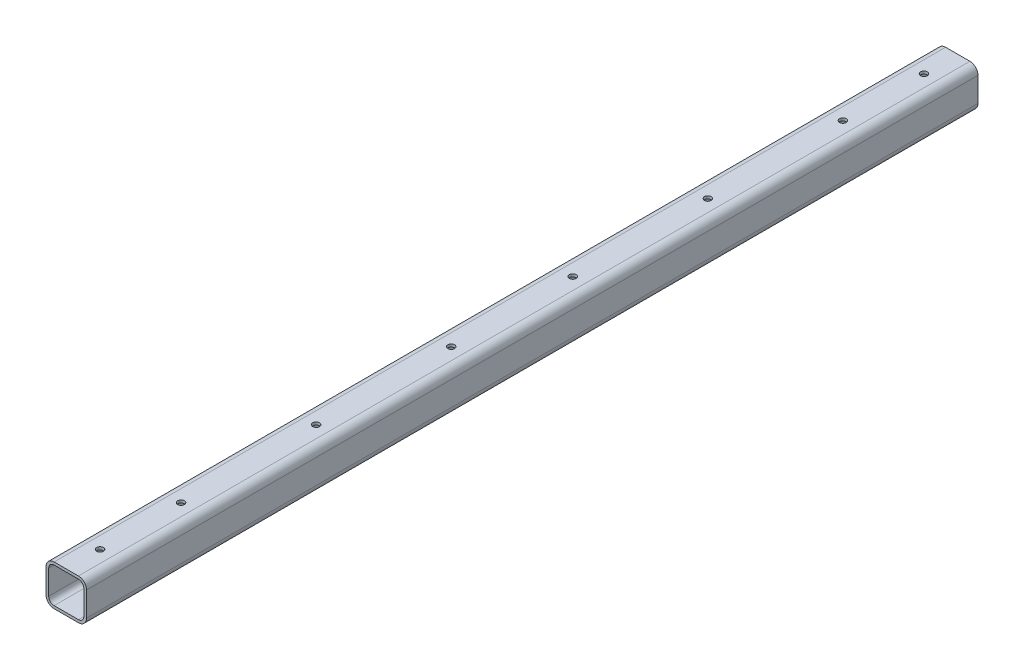
from build123d import *

# Parameters (mm, degrees)
AUFSATZ_LINEAR_AUSTRAGEN1_DEPTH = 330
SKIZZE2_R                       = 2.5
SCHNITT_LINEAR_AUSTRAGEN1_DEPTH = 60


with BuildPart() as part:
    # Skizze1 → Aufsatz-Linear austragen1 (new, symmetric)
    with BuildSketch(Plane.XY):
        with BuildLine():
            Line((-9, 15), (9, 15))
            ThreePointArc((9, 15), (13.242640687, 13.242640687), (15, 9))
            Line((15, 9), (15, -9))
            ThreePointArc((15, -9), (13.242640687, -13.242640687), (9, -15))
            Line((9, -15), (-9, -15))
            ThreePointArc((-9, -15), (-13.242640687, -13.242640687), (-15, -9))
            Line((-15, -9), (-15, 9))
            ThreePointArc((-15, 9), (-13.242640687, 13.242640687), (-9, 15))
        make_face()
        with BuildLine():
            Line((-13, 9), (-13, -9))
            ThreePointArc((-13, -9), (-11.828427125, -11.828427125), (-9, -13))
            Line((-9, -13), (9, -13))
            ThreePointArc((9, -13), (11.828427125, -11.828427125), (13, -9))
            Line((13, -9), (13, 9))
            ThreePointArc((13, 9), (11.828427125, 11.828427125), (9, 13))
            Line((9, 13), (-9, 13))
            ThreePointArc((-9, 13), (-11.828427125, 11.828427125), (-13, 9))
        make_face(mode=Mode.SUBTRACT)
    extrude(amount=AUFSATZ_LINEAR_AUSTRAGEN1_DEPTH, both=True)

    # Skizze2 → Schnitt-Linear austragen1 (cut)
    with BuildSketch(Plane.XZ.offset(15)):
        with Locations(Location((0, -305, 0), (0, 0, 270))):
            Circle(SKIZZE2_R)
        with Locations(Location((0, -245, 0), (0, 0, 270))):
            Circle(SKIZZE2_R)
        with Locations(Location((0, -145, 0), (0, 0, 270))):
            Circle(SKIZZE2_R)
        with Locations(Location((0, -45, 0), (0, 0, 270))):
            Circle(SKIZZE2_R)
        with Locations(Location((0, 45, 0), (0, 0, 270))):
            Circle(SKIZZE2_R)
        with Locations(Location((0, 145, 0), (0, 0, 270))):
            Circle(SKIZZE2_R)
        with Locations(Location((0, 245, 0), (0, 0, 270))):
            Circle(SKIZZE2_R)
        with Locations(Location((0, 305, 0), (0, 0, 270))):
            Circle(SKIZZE2_R)
    extrude(amount=-SCHNITT_LINEAR_AUSTRAGEN1_DEPTH, mode=Mode.SUBTRACT)


solid = part.part
